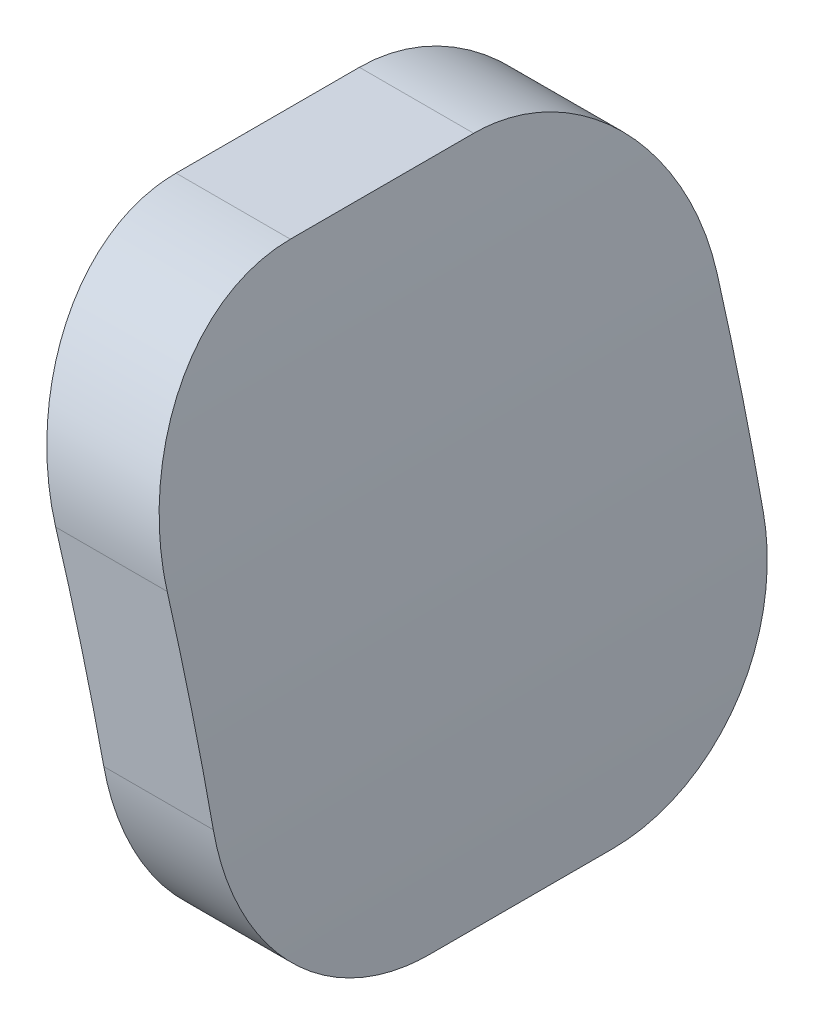
from build123d import *

# Parameters (mm, degrees)
BOSS_EXTRUDE2_DEPTH     = 1066.8
CUT_EXTRUDE1_DEPTH      = 2806.00308884
CUT_EXTRUDE1_DEPTH_BACK = 2806.00308884


with BuildPart() as part:
    # Sketch1 → Boss-Extrude2 (new body)
    with BuildSketch(Plane.XY):
        with BuildLine():
            Line((1708.013552171, 1308.1), (1818.71626935, 1308.1))
            ThreePointArc((1818.71626935, 1308.1), (2198.04838822, 432.940829033), (2178.927715276, -520.7))
            Line((2178.927715276, -520.7), (2087.416444891, -520.7))
            ThreePointArc((2087.416444891, -520.7), (2106.525474721, 437.019826496), (1708.013552171, 1308.1))
        make_face()
    extrude(amount=BOSS_EXTRUDE2_DEPTH)

    # Sketch2 → Cut-Extrude1 (cut, two sides: drawn at the far end of the back side and taken through both)
    with BuildSketch(Plane(origin=(0, 0, 0), x_dir=(0, 0, -1), z_dir=(1, 0, 0)).offset(-CUT_EXTRUDE1_DEPTH_BACK)):
        with BuildLine():
            Line((-6736.08, -5778.5), (5669.28, -5778.5))
            ThreePointArc((5669.28, -5778.5), (5755.490458762, -5742.790458762), (5791.2, -5656.58))
            Line((5791.2, -5656.58), (5791.2, 6748.78))
            ThreePointArc((5791.2, 6748.78), (5755.490458762, 6834.990458762), (5669.28, 6870.7))
            Line((5669.28, 6870.7), (-6736.08, 6870.7))
            ThreePointArc((-6736.08, 6870.7), (-6822.290458762, 6834.990458762), (-6858, 6748.78))
            Line((-6858, 6748.78), (-6858, -5656.58))
            ThreePointArc((-6858, -5656.58), (-6822.290458762, -5742.790458762), (-6736.08, -5778.5))
        make_face()
        with BuildLine():
            Line((-609.6, 317.5), (-457.2, 317.5))
            ThreePointArc((-457.2, 317.5), (-349.436926547, 362.136926547), (-304.8, 469.9))
            Line((-304.8, 469.9), (-304.8, 622.3))
            ThreePointArc((-304.8, 622.3), (-349.436926547, 730.063073453), (-457.2, 774.7))
            Line((-457.2, 774.7), (-609.6, 774.7))
            ThreePointArc((-609.6, 774.7), (-717.363073453, 730.063073453), (-762, 622.3))
            Line((-762, 622.3), (-762, 469.9))
            ThreePointArc((-762, 469.9), (-717.363073453, 362.136926547), (-609.6, 317.5))
        make_face(mode=Mode.SUBTRACT)
    extrude(amount=CUT_EXTRUDE1_DEPTH + CUT_EXTRUDE1_DEPTH_BACK, mode=Mode.SUBTRACT)


solid = part.part
